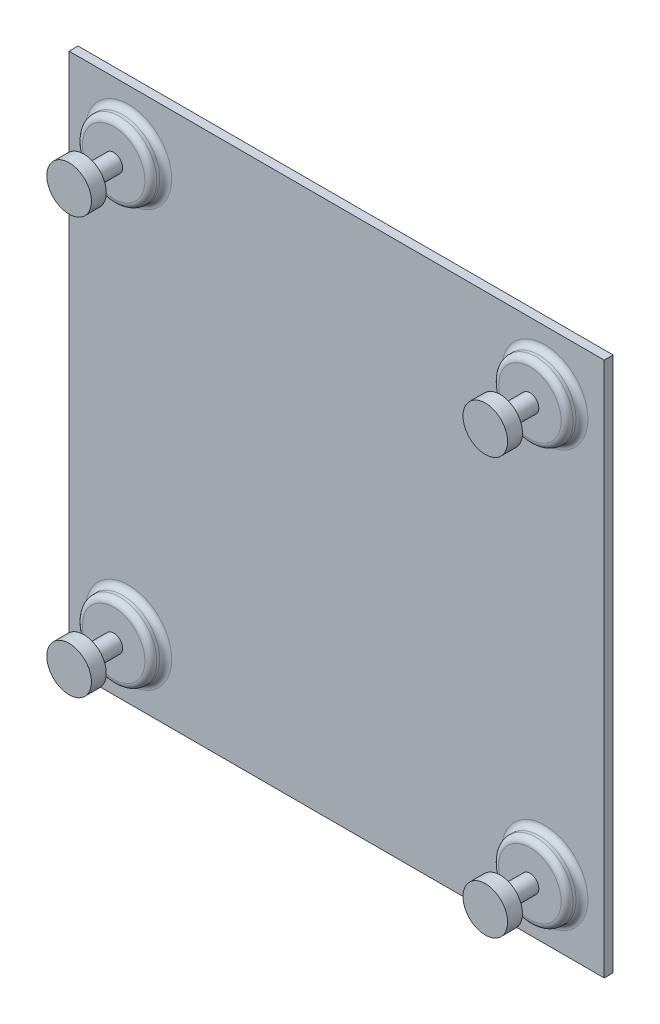
from build123d import *

# Parameters (mm, degrees)
SKETCH1_W           = 228.6
SKETCH1_H           = 228.6
BOSS_EXTRUDE1_DEPTH = 3.81
SKETCH2_R           = 15.875
BOSS_EXTRUDE2_DEPTH = 6.35
SKETCH3_R           = 3.81
BOSS_EXTRUDE3_DEPTH = 12.7
SKETCH4_R           = 9.525
BOSS_EXTRUDE4_DEPTH = 6.35
FILLET1_R           = 2.54
FILLET2_R           = 2.54


with BuildPart() as part:
    # Sketch1 → Boss-Extrude1 (new body)
    with BuildSketch(Plane.XY):
        Rectangle(SKETCH1_W, SKETCH1_H)
    extrude(amount=BOSS_EXTRUDE1_DEPTH)

    # Sketch2 → Boss-Extrude2 (add)
    with BuildSketch(Plane.XY.offset(3.81)):
        with Locations(Location((88.9, -88.9, 0), (0, 0, 180))):
            Circle(SKETCH2_R)
        with Locations(Location((88.9, 88.9, 0), (0, 0, 180))):
            Circle(SKETCH2_R)
        with Locations(Location((-88.9, -88.9, 0), (0, 0, 180))):
            Circle(SKETCH2_R)
        with Locations(Location((-88.9, 88.9, 0), (0, 0, 180))):
            Circle(SKETCH2_R)
    extrude(amount=BOSS_EXTRUDE2_DEPTH)

    # Sketch3 → Boss-Extrude3 (add)
    with BuildSketch(Plane.XY.offset(10.16)):
        with Locations((-88.9, -88.9)):
            Circle(SKETCH3_R)
        with Locations((-88.9, 88.9)):
            Circle(SKETCH3_R)
        with Locations((88.9, -88.9)):
            Circle(SKETCH3_R)
        with Locations((88.9, 88.9)):
            Circle(SKETCH3_R)
    extrude(amount=BOSS_EXTRUDE3_DEPTH)

    # Sketch4 → Boss-Extrude4 (add)
    with BuildSketch(Plane.XY.offset(22.86)):
        with Locations((-88.9, -88.9)):
            Circle(SKETCH4_R)
        with Locations((-88.9, 88.9)):
            Circle(SKETCH4_R)
        with Locations((88.9, 88.9)):
            Circle(SKETCH4_R)
        with Locations((88.9, -88.9)):
            Circle(SKETCH4_R)
    extrude(amount=BOSS_EXTRUDE4_DEPTH)

    # Fillet1
    fillet1_edges = [part.edges().sort_by_distance(p)[0] for p in [
        (104.775, -88.9, 10.16),
        (104.775, 88.9, 10.16),
        (-73.025, -88.9, 10.16),
        (-73.025, 88.9, 10.16),
    ]]
    fillet(fillet1_edges, radius=FILLET1_R)

    # Fillet2
    fillet2_edges = [part.edges().sort_by_distance(p)[0] for p in [
        (104.775, -88.9, 3.81),
        (104.775, 88.9, 3.81),
        (-73.025, -88.9, 3.81),
        (-73.025, 88.9, 3.81),
    ]]
    fillet(fillet2_edges, radius=FILLET2_R)


solid = part.part
